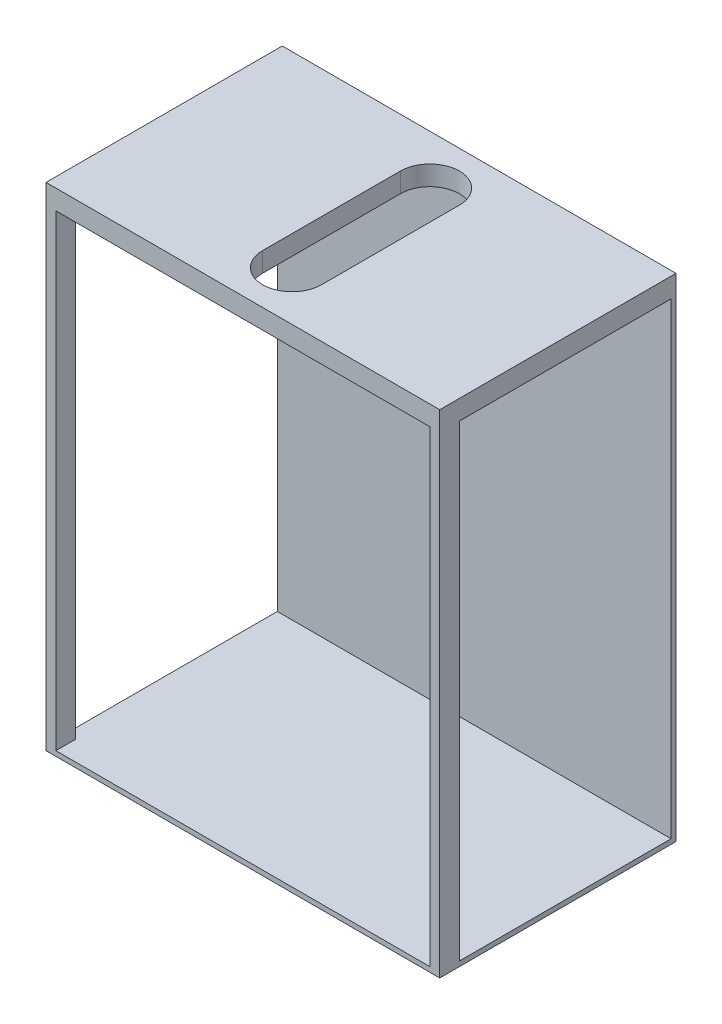
from build123d import *

# Parameters (mm, degrees)
SKETCH1_W           = 508
SKETCH1_H           = 635
BOSS_EXTRUDE1_DEPTH = 6.35
SKETCH3_W           = 508
SKETCH3_H           = 298.45
BOSS_EXTRUDE3_DEPTH = 6.35
BOSS_EXTRUDE4_DEPTH = 12.7
SKETCH6_W           = 298.45
SKETCH6_H           = 25.4
BOSS_EXTRUDE6_DEPTH = 482.6
CUT_EXTRUDE1_DEPTH  = 25.4


with BuildPart() as part:
    # Sketch1 → Boss-Extrude1 (new body)
    with BuildSketch(Plane.XY):
        with Locations((254, 317.5)):
            Rectangle(SKETCH1_W, SKETCH1_H)
    extrude(amount=BOSS_EXTRUDE1_DEPTH)

    # Sketch3 → Boss-Extrude3 (add)
    with BuildSketch(Plane(origin=(0, 0, 0), x_dir=(1, 0, 0), z_dir=(0, 1, 0))):
        with Locations((254, -155.575)):
            Rectangle(SKETCH3_W, SKETCH3_H)
    extrude(amount=BOSS_EXTRUDE3_DEPTH)

    # Sketch4 → Boss-Extrude4 (add)
    with BuildSketch(Plane(origin=(0, 0, 0), x_dir=(0, 0, -1), z_dir=(1, 0, 0))):
        Polygon((-304.8, 6.35), (-304.8, 635), (-6.35, 635), (-6.35, 609.6), (-279.4, 609.6), (-279.4, 6.35), align=None)
    boss_extrude4 = extrude(amount=BOSS_EXTRUDE4_DEPTH)

    # Mirror1: Boss-Extrude4 across plane
    add(boss_extrude4.mirror(Plane(origin=(254, 0, 0), x_dir=(0, 0, 1), z_dir=(1, 0, 0))))

    # Sketch6 → Boss-Extrude6 (add)
    with BuildSketch(Plane(origin=(12.7, 0, 0), x_dir=(0, 0, -1), z_dir=(1, 0, 0))):
        with Locations((-155.575, 622.3)):
            Rectangle(SKETCH6_W, SKETCH6_H)
    extrude(amount=BOSS_EXTRUDE6_DEPTH)

    # Sketch7 → Cut-Extrude1 (cut)
    with BuildSketch(Plane(origin=(0, 635, 0), x_dir=(1, 0, 0), z_dir=(0, 1, 0))):
        with BuildLine():
            Line((292.1, -63.5), (292.1, -241.3))
            ThreePointArc((292.1, -241.3), (254, -279.4), (215.9, -241.3))
            Line((215.9, -241.3), (215.9, -63.5))
            ThreePointArc((215.9, -63.5), (254, -25.4), (292.1, -63.5))
        make_face()
    extrude(amount=-CUT_EXTRUDE1_DEPTH, mode=Mode.SUBTRACT)


solid = part.part
